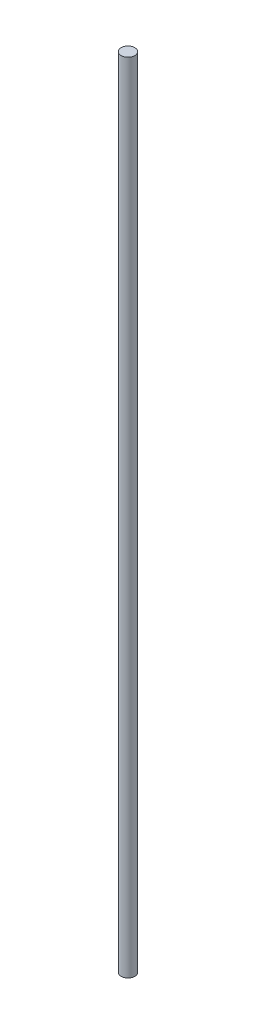
from build123d import *

# Parameters (mm, degrees)
SKETCH1_R           = 2.15
BOSS_EXTRUDE1_DEPTH = 250


with BuildPart() as part:
    # Sketch1 → Boss-Extrude1 (new body)
    with BuildSketch(Plane(origin=(0, 0, 0), x_dir=(1, 0, 0), z_dir=(0, 1, 0))):
        with Locations(Location((0, 0, 0), (0, 0, 270))):
            Circle(SKETCH1_R)
    extrude(amount=BOSS_EXTRUDE1_DEPTH)


solid = part.part
